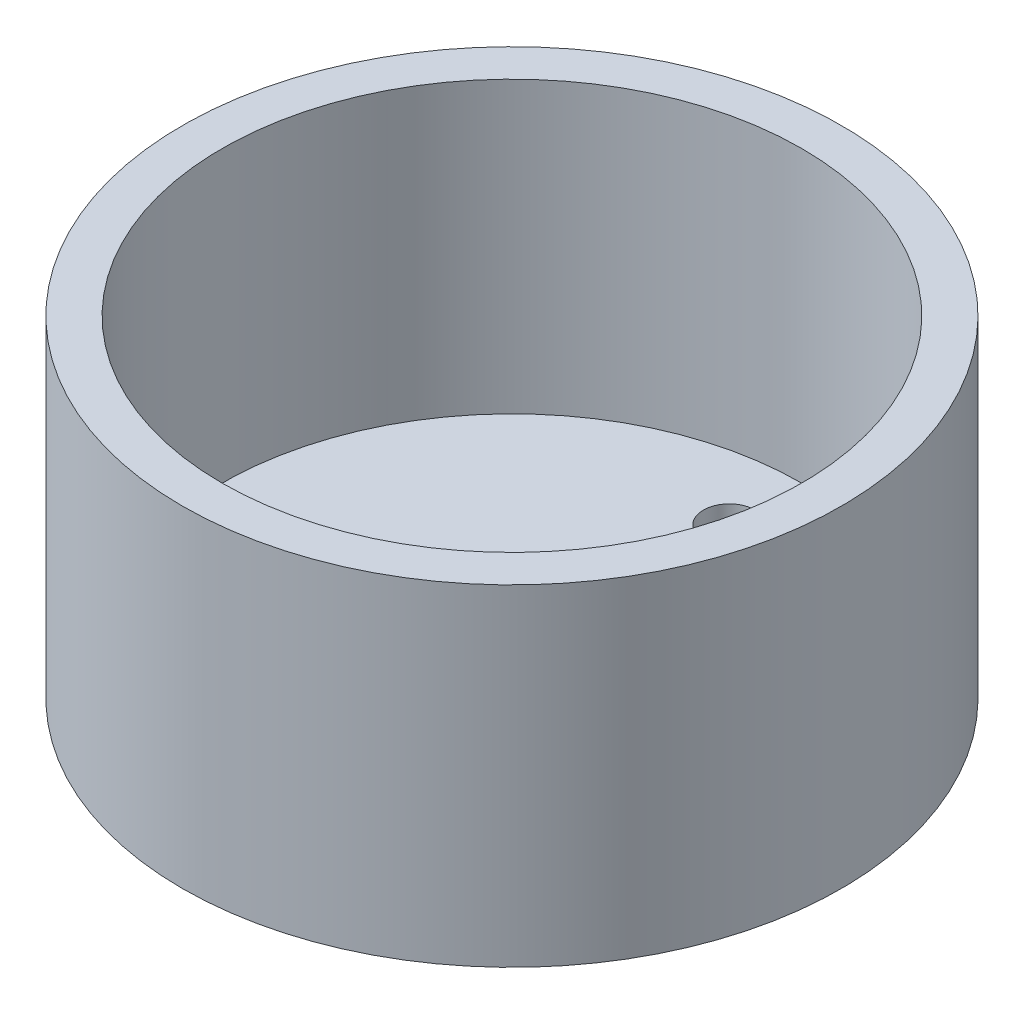
from build123d import *

# Parameters (mm, degrees)
SKETCH1_R           = 50.546
BOSS_EXTRUDE1_DEPTH = 50.8
SKETCH2_R           = 44.45
CUT_EXTRUDE1_DEPTH  = 44.45
SKETCH3_R           = 3.96875
CUT_EXTRUDE2_DEPTH  = 44.45


with BuildPart() as part:
    # Sketch1 → Boss-Extrude1 (new body)
    with BuildSketch(Plane(origin=(0, 0, 0), x_dir=(1, 0, 0), z_dir=(0, 1, 0))):
        with Locations(Location((0, 0, 0), (0, 0, 270))):
            Circle(SKETCH1_R)
    extrude(amount=BOSS_EXTRUDE1_DEPTH)

    # Sketch2 → Cut-Extrude1 (cut)
    with BuildSketch(Plane(origin=(0, 50.8, 0), x_dir=(1, 0, 0), z_dir=(0, 1, 0))):
        with Locations(Location((0, 0, 0), (0, 0, 270))):
            Circle(SKETCH2_R)
    extrude(amount=-CUT_EXTRUDE1_DEPTH, mode=Mode.SUBTRACT)

    # Sketch3 → Cut-Extrude2 (cut)
    with BuildSketch(Plane.XZ):
        with Locations(Location((0, 33.3375, 0), (0, 0, 270))):
            Circle(SKETCH3_R)
        with Locations(Location((0, -33.3375, 0), (0, 0, 270))):
            Circle(SKETCH3_R)
    extrude(amount=-CUT_EXTRUDE2_DEPTH, mode=Mode.SUBTRACT)


solid = part.part
